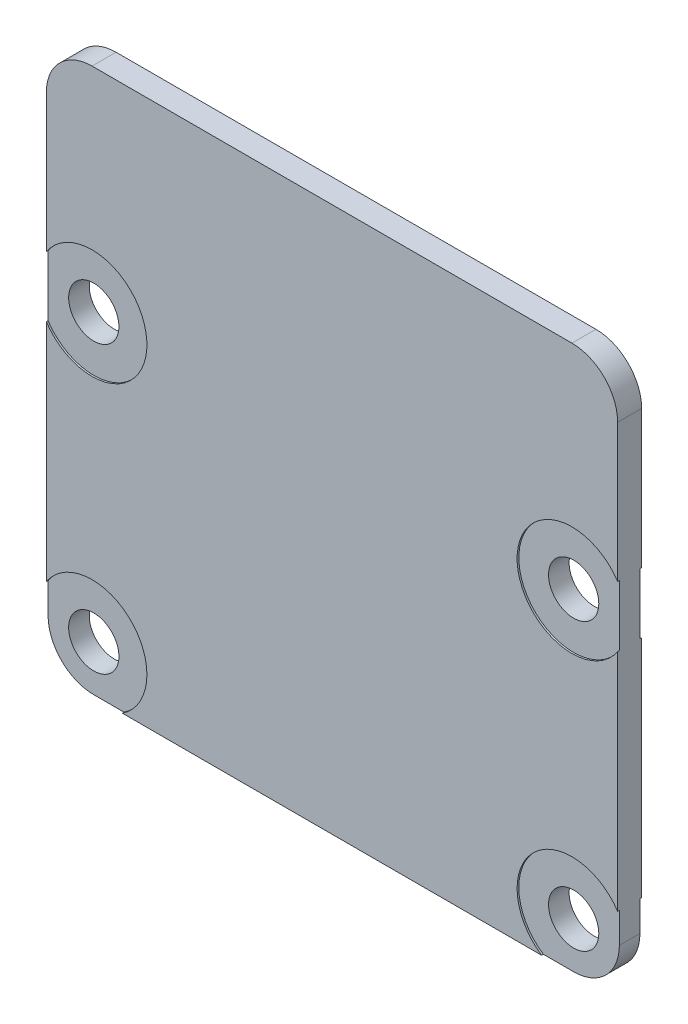
from build123d import *

# Parameters (mm, degrees)
SKETCH3_W           = 25
SKETCH3_H           = 23.862
BOSS_EXTRUDE1_DEPTH = 0.9
FILLET1_R           = 2
SKETCH4_R           = 1.1
CUT_EXTRUDE1_DEPTH  = 20.089787846
BOSS_EXTRUDE2_DEPTH = 0.075
BOSS_EXTRUDE3_START = 0.075
BOSS_EXTRUDE3_DEPTH = 0.075


with BuildPart() as part:
    # Sketch3 → Boss-Extrude1 (new body)
    with BuildSketch(Plane.XY):
        with Locations((0, -2.469)):
            Rectangle(SKETCH3_W, SKETCH3_H)
    extrude(amount=-BOSS_EXTRUDE1_DEPTH)

    # Fillet1
    fillet1_edges = [part.edges().sort_by_distance(p)[0] for p in [
        (-12.5, 9.462, -0.45),
        (12.5, 9.462, -0.45),
        (12.5, -14.4, -0.45),
        (-12.5, -14.4, -0.45),
    ]]
    fillet(fillet1_edges, radius=FILLET1_R)

    # Sketch4 → Cut-Extrude1 (cut, through all)
    with BuildSketch(Plane.XY):
        with Locations((-10.5, 0.1)):
            Circle(SKETCH4_R)
        with Locations((-10.5, -12.4)):
            Circle(SKETCH4_R)
        with Locations((10.5, -12.4)):
            Circle(SKETCH4_R)
        with Locations((10.5, 0.1)):
            Circle(SKETCH4_R)
    extrude(amount=-CUT_EXTRUDE1_DEPTH, mode=Mode.SUBTRACT)

    # Sketch5 → Boss-Extrude2 (add)
    with BuildSketch(Plane.XY):
        with BuildLine():
            Line((12.5, 1.426649916), (12.5, 7.462))
            ThreePointArc((12.5, 7.462), (11.914213562, 8.876213562), (10.5, 9.462))
            Line((10.5, 9.462), (-10.5, 9.462))
            ThreePointArc((-10.5, 9.462), (-11.914213562, 8.876213562), (-12.5, 7.462))
            Line((-12.5, 7.462), (-12.5, 1.426649916))
            ThreePointArc((-12.5, 1.426649916), (-8.1, 0.1), (-12.5, -1.226649916))
            Line((-12.5, -1.226649916), (-12.5, -11.073350084))
            ThreePointArc((-12.5, -11.073350084), (-8.802943725, -10.702943725), (-9.173350084, -14.4))
            Line((-9.173350084, -14.4), (9.173350084, -14.4))
            ThreePointArc((9.173350084, -14.4), (8.802943725, -10.702943725), (12.5, -11.073350084))
            Line((12.5, -11.073350084), (12.5, -1.226649916))
            ThreePointArc((12.5, -1.226649916), (8.1, 0.1), (12.5, 1.426649916))
        make_face()
    extrude(amount=BOSS_EXTRUDE2_DEPTH)

    # Sketch6 → Boss-Extrude3 (add)
    with BuildSketch(Plane(origin=(0, 0, -0.9), x_dir=(-1, 0, 0), z_dir=(0, 0, -1)).offset(BOSS_EXTRUDE3_START)):
        with BuildLine():
            Line((12.5, 1.426649916), (12.5, 7.462))
            ThreePointArc((12.5, 7.462), (11.914213562, 8.876213562), (10.5, 9.462))
            Line((10.5, 9.462), (-10.5, 9.462))
            ThreePointArc((-10.5, 9.462), (-11.914213562, 8.876213562), (-12.5, 7.462))
            Line((-12.5, 7.462), (-12.5, 1.426649916))
            ThreePointArc((-12.5, 1.426649916), (-8.1, 0.1), (-12.5, -1.226649916))
            Line((-12.5, -1.226649916), (-12.5, -11.073350084))
            ThreePointArc((-12.5, -11.073350084), (-8.802943725, -10.702943725), (-9.173350084, -14.4))
            Line((-9.173350084, -14.4), (9.173350084, -14.4))
            ThreePointArc((9.173350084, -14.4), (8.802943725, -10.702943725), (12.5, -11.073350084))
            Line((12.5, -11.073350084), (12.5, -1.226649916))
            ThreePointArc((12.5, -1.226649916), (8.1, 0.1), (12.5, 1.426649916))
        make_face()
    extrude(amount=-BOSS_EXTRUDE3_DEPTH)


solid = part.part
